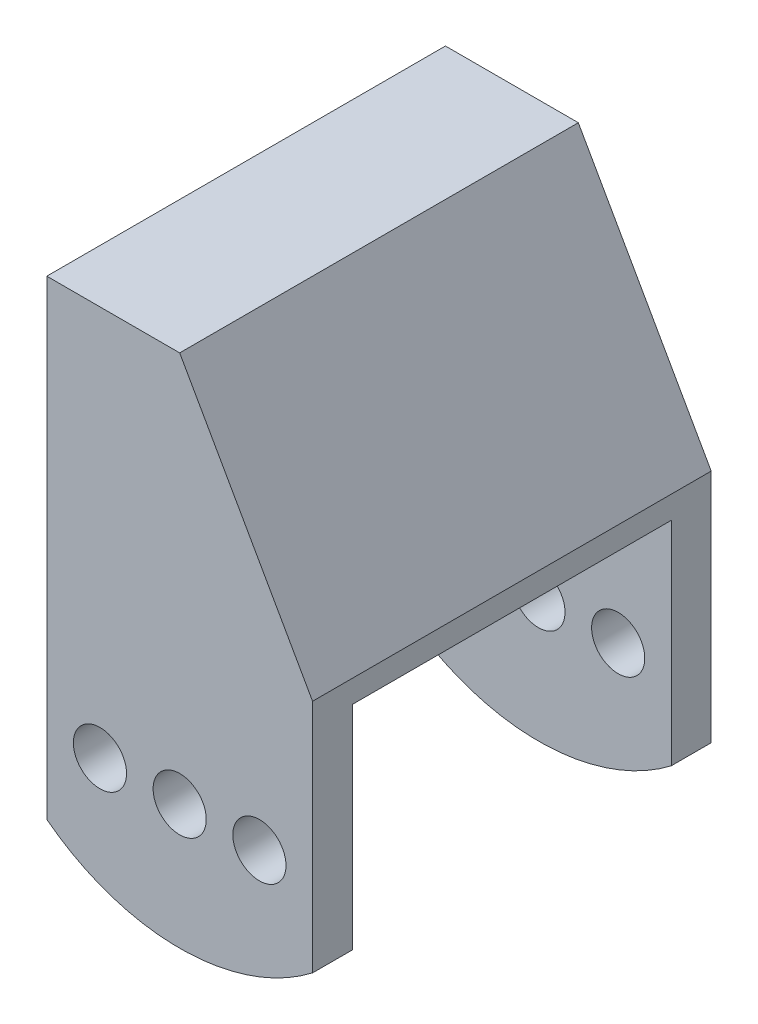
from build123d import *

# Parameters (mm, degrees)
SKETCH1_R           = 2
BOSS_EXTRUDE1_DEPTH = 30
SKETCH2_W           = 24
SKETCH2_H           = 19.394542589
CUT_EXTRUDE1_DEPTH  = 43.435404183
SKETCH3_R           = 8.9
SKETCH3_R_2         = 2
CUT_EXTRUDE2_DEPTH  = 3


with BuildPart() as part:
    # Sketch1 → Boss-Extrude1 (new body)
    with BuildSketch(Plane.XY):
        with BuildLine():
            Line((-10, 22.377746272), (0, 22.377746272))
            Line((0, 22.377746272), (10, 4.672746272))
            Line((10, 4.672746272), (10, -13.032253728))
            ThreePointArc((10, -13.032253728), (0, -16.426796317), (-10, -13.032253728))
            Line((-10, -13.032253728), (-10, 22.377746272))
        make_face()
        with Locations((0, -7.032253728)):
            Circle(SKETCH1_R, mode=Mode.SUBTRACT)
        with Locations((6, -7.032253728)):
            Circle(SKETCH1_R, mode=Mode.SUBTRACT)
        with Locations((-6, -7.032253728)):
            Circle(SKETCH1_R, mode=Mode.SUBTRACT)
    extrude(amount=BOSS_EXTRUDE1_DEPTH)

    # Sketch2 → Cut-Extrude1 (cut, through all)
    with BuildSketch(Plane(origin=(10, 0, 0), x_dir=(0, 0, -1), z_dir=(1, 0, 0))):
        with Locations((-15, -6.729525023)):
            Rectangle(SKETCH2_W, SKETCH2_H)
    extrude(amount=-CUT_EXTRUDE1_DEPTH, mode=Mode.SUBTRACT)

    # Sketch3 → Cut-Extrude2 (cut)
    with BuildSketch(Plane.ZY.offset(10)):
        with Locations((15, 12.967746272)):
            Circle(SKETCH3_R)
        with Locations((15, 18.967746272)):
            Circle(SKETCH3_R_2, mode=Mode.SUBTRACT)
        with Locations((15, 6.967746272)):
            Circle(SKETCH3_R_2, mode=Mode.SUBTRACT)
        with Locations((9, 12.967746272)):
            Circle(SKETCH3_R_2, mode=Mode.SUBTRACT)
        with Locations((21, 12.967746272)):
            Circle(SKETCH3_R_2, mode=Mode.SUBTRACT)
    extrude(amount=-CUT_EXTRUDE2_DEPTH, mode=Mode.SUBTRACT)


solid = part.part
